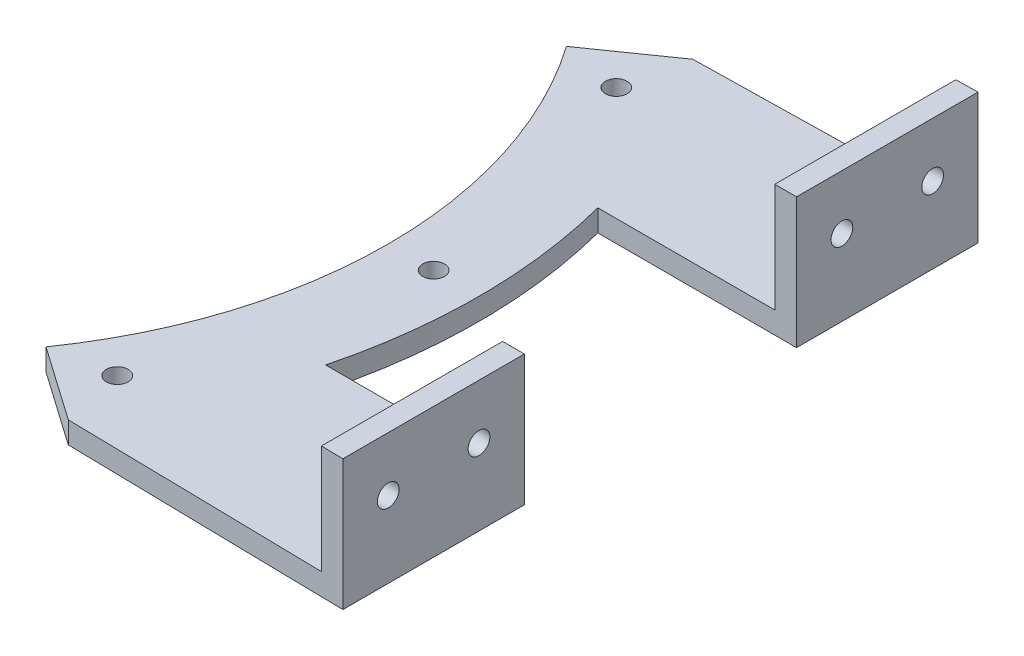
from build123d import *

# Parameters (mm, degrees)
SKETCH1_R           = 6
BOSS_EXTRUDE2_DEPTH = 12
BOSS_EXTRUDE3_DEPTH = 60
SKETCH3_R           = 6
CUT_EXTRUDE1_DEPTH  = 264.394047607


with BuildPart() as part:
    # Sketch1 → Boss-Extrude2 (new body)
    with BuildSketch(Plane(origin=(0, 0, 0), x_dir=(1, 0, 0), z_dir=(0, 1, 0))):
        with BuildLine():
            Line((400, 175), (400, 75))
            Line((400, 75), (290.473750966, 75))
            ThreePointArc((290.473750966, 75), (300, 0), (290.473750966, -75))
            Line((290.473750966, -75), (400, -75))
            Line((400, -75), (400, -175))
            Line((400, -175), (245.745613287, -172.072930905))
            Line((245.745613287, -172.072930905), (204.788011072, -143.394109088))
            ThreePointArc((204.788011072, -143.394109088), (250, 0), (204.788011072, 143.394109088))
            Line((204.788011072, 143.394109088), (245.745613287, 172.072930905))
            Line((245.745613287, 172.072930905), (400, 175))
        make_face()
        with Locations(Location((238.156986041, -137.5, 0), (0, 0, 270))):
            Circle(SKETCH1_R, mode=Mode.SUBTRACT)
        with Locations(Location((275, 0, 0), (0, 0, 270))):
            Circle(SKETCH1_R, mode=Mode.SUBTRACT)
        with Locations(Location((238.156986041, 137.5, 0), (0, 0, 270))):
            Circle(SKETCH1_R, mode=Mode.SUBTRACT)
    extrude(amount=BOSS_EXTRUDE2_DEPTH)

    # Sketch2 → Boss-Extrude3 (add)
    with BuildSketch(Plane(origin=(0, 12, 0), x_dir=(1, 0, 0), z_dir=(0, 1, 0))):
        Polygon((400, 75), (400, 175), (388.002159856, 174.772333819), (388.002159856, 75), align=None)
        Polygon((400, -175), (400, -75), (388.002159856, -75), (388.002159856, -174.772333819), align=None)
    extrude(amount=BOSS_EXTRUDE3_DEPTH)

    # Sketch3 → Cut-Extrude1 (cut, through all)
    with BuildSketch(Plane.ZY.offset(-388.002159856)):
        with Locations((-150, 42)):
            Circle(SKETCH3_R)
        with Locations((-100, 42)):
            Circle(SKETCH3_R)
        with Locations((100, 42)):
            Circle(SKETCH3_R)
        with Locations((150, 42)):
            Circle(SKETCH3_R)
    extrude(amount=-CUT_EXTRUDE1_DEPTH, mode=Mode.SUBTRACT)


solid = part.part
